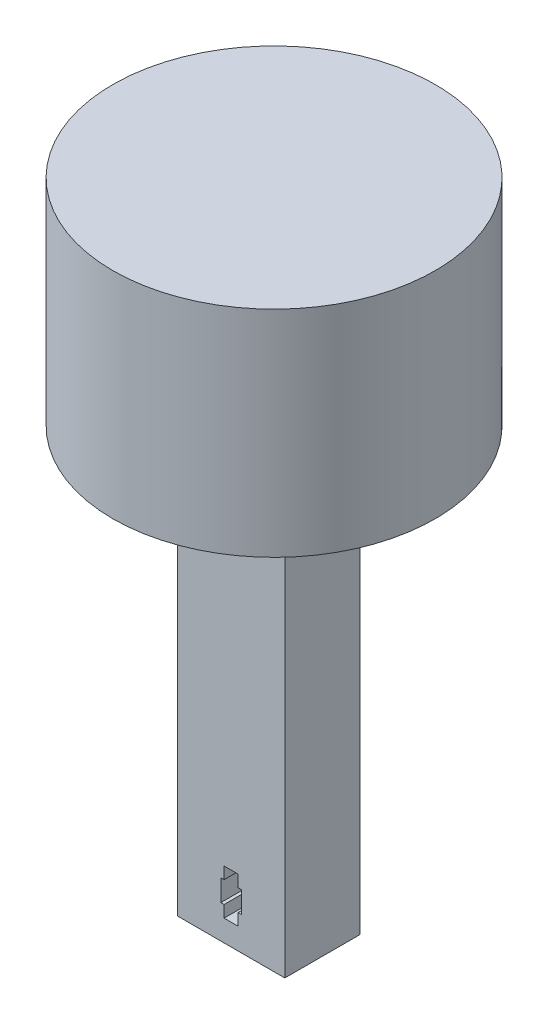
from build123d import *

# Parameters (mm, degrees)
SKETCH_1_R          = 15
EXTRUDE_1_DEPTH     = 20
SKETCH_2_R          = 1.5
CUT_EXTRUDE_1_DEPTH = 15
SKETCH_3_W          = 10
SKETCH_3_H          = 7
EXTRUDE_2_DEPTH     = 40
SKETCH_4_W          = 1.3
SKETCH_4_H          = 4.2
CUT_EXTRUDE_2_DEPTH = 47.75467891
SKETCH_5_W          = 1.3
SKETCH_5_H          = 5.2
CUT_EXTRUDE_3_DEPTH = 2
SKETCH_6_W          = 1.9
SKETCH_6_H          = 2
CUT_EXTRUDE_4_DEPTH = 47.75467891


with BuildPart() as part:
    # 草图1 → 凸台-拉伸1 (new body)
    with BuildSketch(Plane(origin=(0, 0, 0), x_dir=(1, 0, 0), z_dir=(0, 1, 0))):
        with Locations(Location((0, 0, 0), (0, 0, 270))):
            Circle(SKETCH_1_R)
    extrude(amount=EXTRUDE_1_DEPTH)

    # 草图2 → 切除-拉伸1 (cut)
    with BuildSketch(Plane.XZ):
        with Locations(Location((12, 0, 0), (0, 0, 270))):
            Circle(SKETCH_2_R)
        with Locations(Location((-12, 0, 0), (0, 0, 90))):
            Circle(SKETCH_2_R)
    extrude(amount=-CUT_EXTRUDE_1_DEPTH, mode=Mode.SUBTRACT)

    # 草图3 → 凸台-拉伸2 (add)
    with BuildSketch(Plane.XZ):
        with Locations((0, 0.5)):
            Rectangle(SKETCH_3_W, SKETCH_3_H)
    extrude(amount=EXTRUDE_2_DEPTH)

    # 草图4 → 切除-拉伸2 (cut, through all)
    with BuildSketch(Plane.XY.offset(4)):
        with Locations((0, -35.9)):
            Rectangle(SKETCH_4_W, SKETCH_4_H)
    extrude(amount=-CUT_EXTRUDE_2_DEPTH, mode=Mode.SUBTRACT)

    # 草图5 → 切除-拉伸3 (cut)
    with BuildSketch(Plane.XY.offset(-3)):
        with Locations((0, -35.9)):
            Rectangle(SKETCH_5_W, SKETCH_5_H)
    extrude(amount=CUT_EXTRUDE_3_DEPTH, mode=Mode.SUBTRACT)

    # 草图6 → 切除-拉伸4 (cut, through all)
    with BuildSketch(Plane.XY.offset(4)):
        with Locations((0, -35.9)):
            Rectangle(SKETCH_6_W, SKETCH_6_H)
    extrude(amount=-CUT_EXTRUDE_4_DEPTH, mode=Mode.SUBTRACT)


solid = part.part
